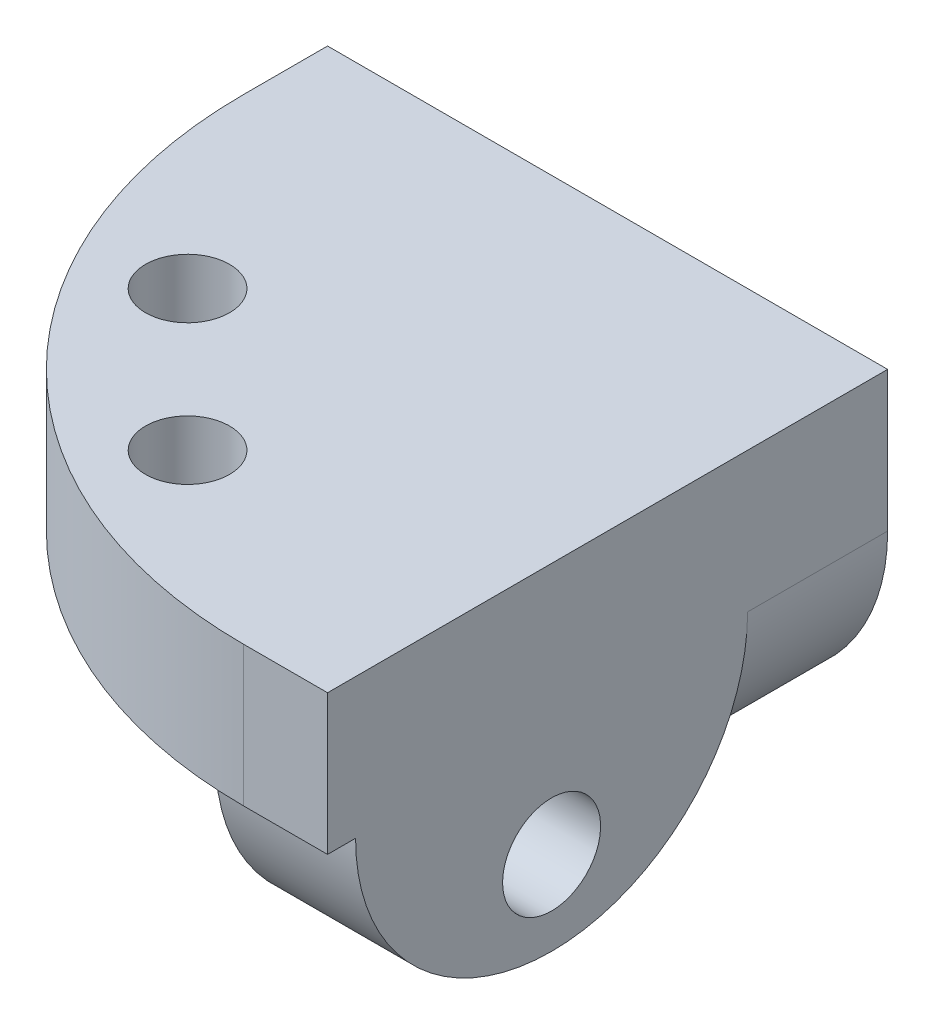
from build123d import *

# Parameters (mm, degrees)
SKETCH1_W           = 20
SKETCH1_H           = 20
SKETCH1_R           = 1.5
BOSS_EXTRUDE1_DEPTH = 5
SKETCH2_R           = 1.75
BOSS_EXTRUDE2_DEPTH = 5
SKETCH3_R           = 1.75
BOSS_EXTRUDE3_DEPTH = 5
FILLET1_R           = 17
SKETCH6_W           = 20.002886454
SKETCH6_H           = 14.057624509
CUT_EXTRUDE1_DEPTH  = 21


with BuildPart() as part:
    # Sketch1 → Boss-Extrude1 (new body)
    with BuildSketch(Plane(origin=(0, 0, 0), x_dir=(1, 0, 0), z_dir=(0, 1, 0))):
        with Locations((10, 10)):
            Rectangle(SKETCH1_W, SKETCH1_H)
        with Locations(Location((10, 15, 0), (0, 0, 270))):
            Circle(SKETCH1_R, mode=Mode.SUBTRACT)
        with Locations(Location((15, 10, 0), (0, 0, 270))):
            Circle(SKETCH1_R, mode=Mode.SUBTRACT)
    extrude(amount=BOSS_EXTRUDE1_DEPTH)

    # Sketch2 → Boss-Extrude2 (add)
    with BuildSketch(Plane.XY):
        with BuildLine():
            Line((19, 0), (5, 0))
            ThreePointArc((5, 0), (12, -7), (19, 0))
        make_face()
        with Locations((12, -4)):
            Circle(SKETCH2_R, mode=Mode.SUBTRACT)
    extrude(amount=-BOSS_EXTRUDE2_DEPTH)

    # Sketch3 → Boss-Extrude3 (add)
    with BuildSketch(Plane.ZY):
        with BuildLine():
            Line((0, 0), (-14, 0))
            ThreePointArc((-14, 0), (-7, -7), (0, 0))
        make_face()
        with Locations((-7, -4)):
            Circle(SKETCH3_R, mode=Mode.SUBTRACT)
    extrude(amount=-BOSS_EXTRUDE3_DEPTH)

    # Fillet1
    fillet1_edges = [part.edges().sort_by_distance(p)[0] for p in [
        (20, 2.5, -20),
    ]]
    fillet(fillet1_edges, radius=FILLET1_R)


with BuildPart() as body_2:
    # Mirror2: mirrored copy
    add(part.part.mirror(Plane(origin=(18.4519176, 2.234e-06, -18.4519176), x_dir=(0.7071067811865386, 8.560065395974117e-08, 0.7071067811865512), z_dir=(0.7071067811865464, 8.560065395974213e-08, -0.7071067811865437))))


with BuildPart() as part_1:
    add(part.part)

    # Sketch6 → Cut-Extrude1 (cut)
    with BuildSketch(Plane.ZY):
        with Locations((-10.001443227, -2.028812255)):
            Rectangle(SKETCH6_W, SKETCH6_H)
    extrude(amount=-CUT_EXTRUDE1_DEPTH, mode=Mode.SUBTRACT)


solid = body_2.part
